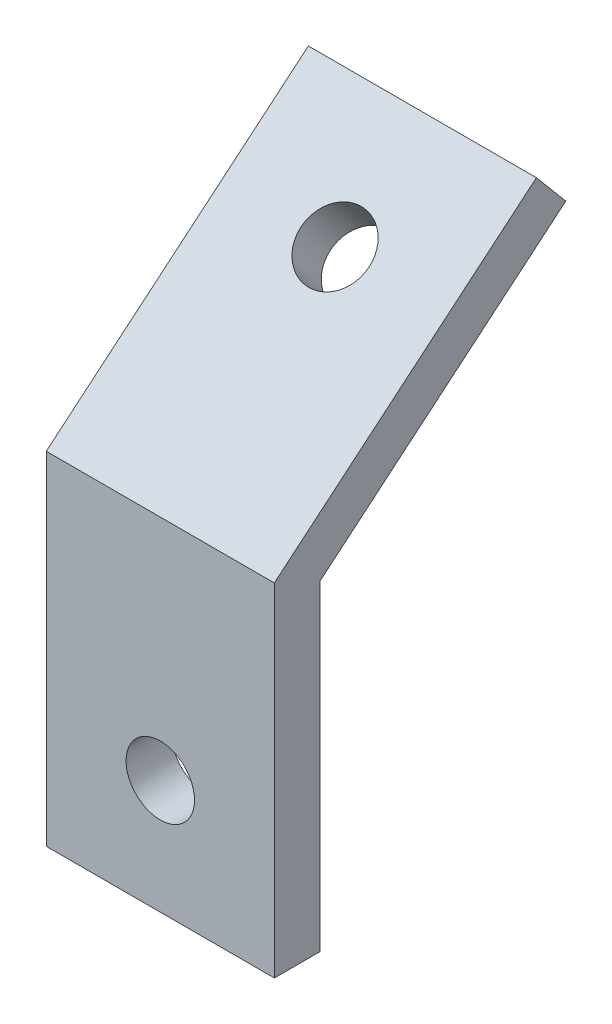
from build123d import *

# Parameters (mm, degrees)
BOSS_EXTRUDE1_DEPTH = 10
SKETCH2_R           = 1.5
CUT_EXTRUDE1_DEPTH  = 10
SKETCH4_R           = 1.5
CUT_EXTRUDE2_DEPTH  = 10


with BuildPart() as part:
    # Sketch1 → Boss-Extrude1 (new body)
    with BuildSketch(Plane(origin=(0, 0, 0), x_dir=(0, 0, -1), z_dir=(1, 0, 0))):
        Polygon((0, 0), (0, 15), (11.490666647, 24.641814145), (12.776241866, 23.109725259), (2, 14.067384684), (2, 0), align=None)
    extrude(amount=BOSS_EXTRUDE1_DEPTH)

    # Sketch2 → Cut-Extrude1 (cut)
    with BuildSketch(Plane.XY):
        with Locations((5, 5)):
            Circle(SKETCH2_R)
    extrude(amount=-CUT_EXTRUDE1_DEPTH, mode=Mode.SUBTRACT)

    # Sketch4 → Cut-Extrude2 (cut)
    with BuildSketch(Plane(origin=(0, 8.802361333, 7.386058148), x_dir=(1, 0, 0), z_dir=(0, 0.7660444431189788, 0.6427876096865384))):
        with Locations(Location((5, 19.641814145, 0), (0, 0, 270))):
            Circle(SKETCH4_R)
    extrude(amount=-CUT_EXTRUDE2_DEPTH, mode=Mode.SUBTRACT)


solid = part.part
